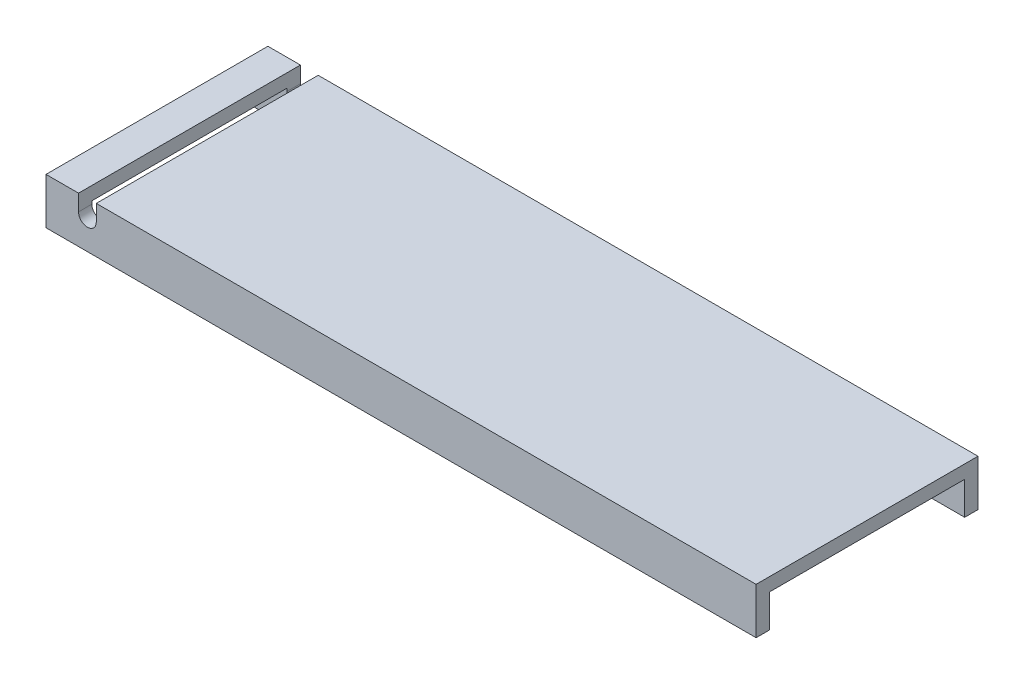
from build123d import *

# Parameters (mm, degrees)
SKETCH_1_W          = 25
SKETCH_1_H          = 10.9
SKETCH_1_W_2        = 22
SKETCH_1_H_2        = 7.9
EXTRUDE_1_DEPTH     = 80
SKETCH_3_W          = 141.586461115
SKETCH_3_H          = 11.077241851
CUT_EXTRUDE_1_DEPTH = 50


with BuildPart() as part:
    # 草图1 → 凸台-拉伸1 (new body)
    with BuildSketch(Plane(origin=(0, 0, 0), x_dir=(0, 0, -1), z_dir=(1, 0, 0))):
        with Locations((1.108975332, -0.23755131)):
            Rectangle(SKETCH_1_W, SKETCH_1_H)
        with Locations((1.108975332, -0.23755131)):
            Rectangle(SKETCH_1_W_2, SKETCH_1_H_2, mode=Mode.SUBTRACT)
    extrude(amount=EXTRUDE_1_DEPTH)

    # 草图3 → 切除-拉伸1 (cut)
    with BuildSketch(Plane.XY.offset(11.391024668)):
        with BuildLine():
            Line((3.664305979, 3.387279606), (3.664305979, 5.21244869))
            Line((3.664305979, 5.21244869), (5.664305979, 5.21244869))
            Line((5.664305979, 5.21244869), (5.664305979, 3.387279606))
            ThreePointArc((5.664305979, 3.387279606), (4.664305979, 2.387279606), (3.664305979, 3.387279606))
        make_face()
        with Locations((67.57974516, -5.538620926)):
            Rectangle(SKETCH_3_W, SKETCH_3_H)
    extrude(amount=-CUT_EXTRUDE_1_DEPTH, mode=Mode.SUBTRACT)


solid = part.part
